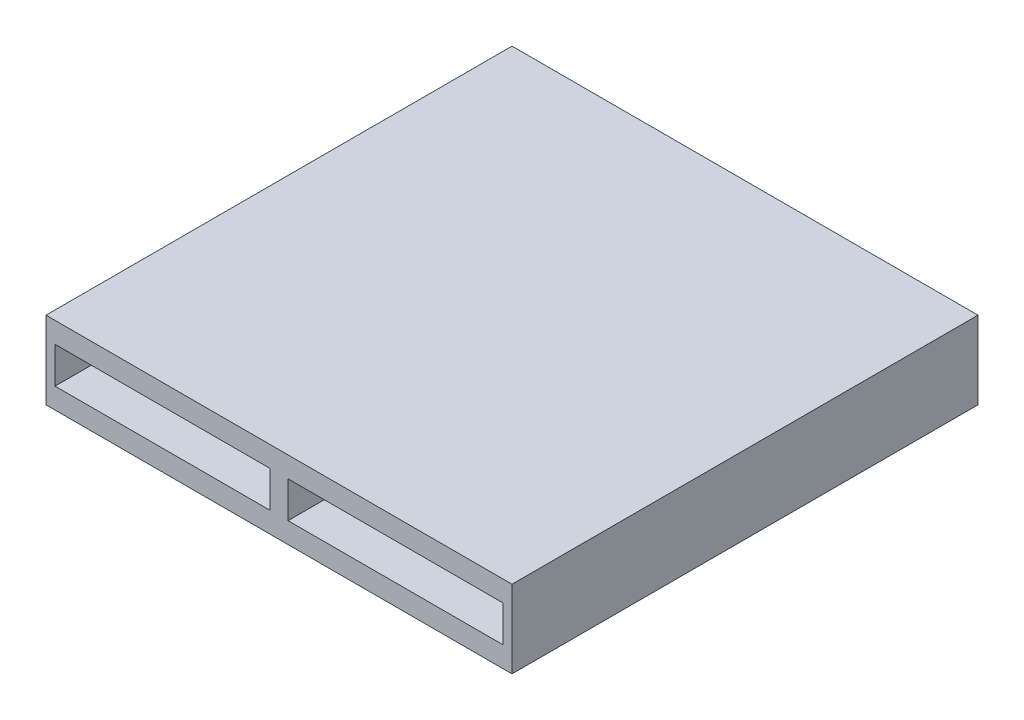
from build123d import *

# Parameters (mm, degrees)
SKETCH1_W           = 90
SKETCH1_H           = 90
BOSS_EXTRUDE1_DEPTH = 15
SKETCH2_W           = 41.5
SKETCH2_H           = 7
CUT_EXTRUDE1_DEPTH  = 90


with BuildPart() as part:
    # Sketch1 → Boss-Extrude1 (new body)
    with BuildSketch(Plane(origin=(0, 0, 0), x_dir=(1, 0, 0), z_dir=(0, 1, 0))):
        Rectangle(SKETCH1_W, SKETCH1_H)
    extrude(amount=BOSS_EXTRUDE1_DEPTH)

    # Sketch2 → Cut-Extrude1 (cut)
    with BuildSketch(Plane.XY.offset(45)):
        with Locations((-22.5, 7.5)):
            Rectangle(SKETCH2_W, SKETCH2_H)
        with Locations((22.5, 7.5)):
            Rectangle(SKETCH2_W, SKETCH2_H)
    extrude(amount=-CUT_EXTRUDE1_DEPTH, mode=Mode.SUBTRACT)


solid = part.part
